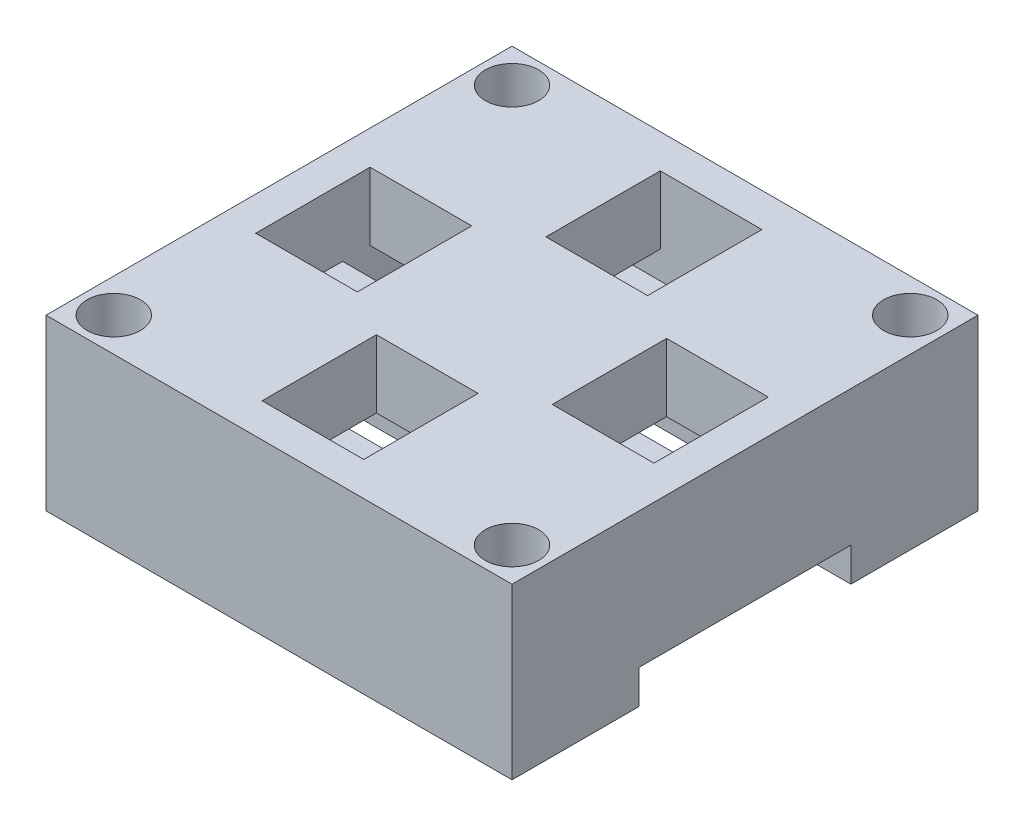
from build123d import *

# Parameters (mm, degrees)
SKETCH1_W           = 55
SKETCH1_H           = 55
SKETCH1_W_2         = 12
SKETCH1_H_2         = 13.5
BOSS_EXTRUDE1_DEPTH = 8
SKETCH2_W           = 55
SKETCH2_H           = 55
BOSS_EXTRUDE7_DEPTH = 12
SKETCH2_5_W         = 23.6
SKETCH2_5_H         = 7
SKETCH2_5_W_2       = 47
BOSS_EXTRUDE8_DEPTH = 8
SKETCH6_R           = 3.15
CUT_EXTRUDE1_DEPTH  = 44.732139211
SKETCH7_W           = 24.995653022
SKETCH7_H           = 4
CUT_EXTRUDE3_DEPTH  = 4


with BuildPart() as part:
    # Sketch1 → Boss-Extrude1 (new body)
    with BuildSketch(Plane(origin=(0, 0, 0), x_dir=(1, 0, 0), z_dir=(0, 1, 0))):
        Rectangle(SKETCH1_W, SKETCH1_H)
        with Locations((0, 16.75)):
            Rectangle(SKETCH1_W_2, SKETCH1_H_2, mode=Mode.SUBTRACT)
        with Locations((17.5, 0)):
            Rectangle(SKETCH1_W_2, SKETCH1_H_2, mode=Mode.SUBTRACT)
        with Locations((-17.5, 0)):
            Rectangle(SKETCH1_W_2, SKETCH1_H_2, mode=Mode.SUBTRACT)
        with Locations((0, -16.75)):
            Rectangle(SKETCH1_W_2, SKETCH1_H_2, mode=Mode.SUBTRACT)
    extrude(amount=BOSS_EXTRUDE1_DEPTH)

    # Sketch2 → Boss-Extrude7 (add)
    with BuildSketch(Plane.XZ):
        Rectangle(SKETCH2_W, SKETCH2_H)
        Polygon((-23.5, 23.5), (-6, 23.5), (6, 23.5), (23.5, 23.5), (23.5, 6.75), (23.5, 3.5), (23.5, -3.5), (23.5, -6.75), (23.5, -23.5), (6, -23.5), (-6, -23.5), (-23.5, -23.5), (-23.5, -6.75), (-23.5, -3.5), (-23.5, 3.5), (-23.5, 6.75), align=None, mode=Mode.SUBTRACT)
    extrude(amount=BOSS_EXTRUDE7_DEPTH)

    # Sketch2<5> → Boss-Extrude8 (add)
    with BuildSketch(Plane.XZ):
        with Locations((-0.1, 16.75)):
            Rectangle(SKETCH2_5_W, SKETCH2_5_H)
        Rectangle(SKETCH2_5_W_2, SKETCH2_5_H)
        with Locations((-0.1, -16.75)):
            Rectangle(SKETCH2_5_W, SKETCH2_5_H)
    extrude(amount=BOSS_EXTRUDE8_DEPTH)

    # Sketch6 → Cut-Extrude1 (cut, through all)
    with BuildSketch(Plane.XZ.offset(12)):
        with Locations((-23.5, 23.5)):
            Circle(SKETCH6_R)
        with Locations((23.5, 23.5)):
            Circle(SKETCH6_R)
        with Locations((-23.5, -23.5)):
            Circle(SKETCH6_R)
        with Locations((23.5, -23.5)):
            Circle(SKETCH6_R)
    extrude(amount=-CUT_EXTRUDE1_DEPTH, mode=Mode.SUBTRACT)

    # Sketch7 → Cut-Extrude3 (cut)
    with BuildSketch(Plane(origin=(27.5, 0, 0), x_dir=(0, 0, -1), z_dir=(1, 0, 0))):
        with Locations((0, -10)):
            Rectangle(SKETCH7_W, SKETCH7_H)
    extrude(amount=-CUT_EXTRUDE3_DEPTH, mode=Mode.SUBTRACT)


solid = part.part
